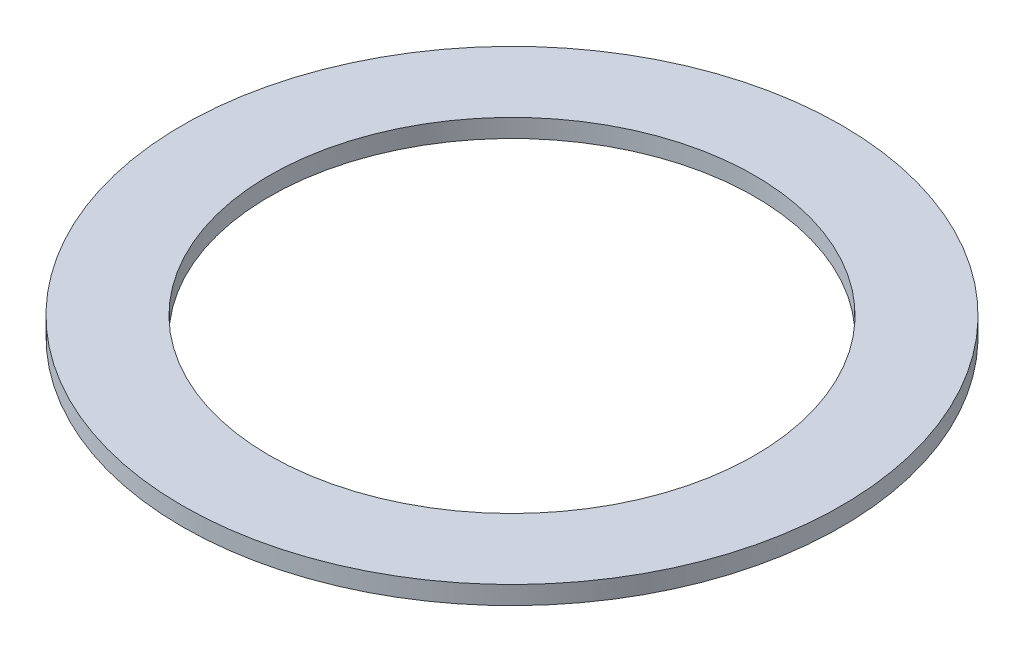
from build123d import *

# Parameters (mm, degrees)
SKETCH1_R           = 36
SKETCH1_R_2         = 26.5
BOSS_EXTRUDE1_DEPTH = 2


with BuildPart() as part:
    # Sketch1 → Boss-Extrude1 (new body)
    with BuildSketch(Plane(origin=(0, 0, 0), x_dir=(1, 0, 0), z_dir=(0, 1, 0))):
        with Locations(Location((0, 0, 0), (0, 0, 270))):
            Circle(SKETCH1_R)
        with Locations(Location((0, 0, 0), (0, 0, 270))):
            Circle(SKETCH1_R_2, mode=Mode.SUBTRACT)
    extrude(amount=BOSS_EXTRUDE1_DEPTH)


solid = part.part
